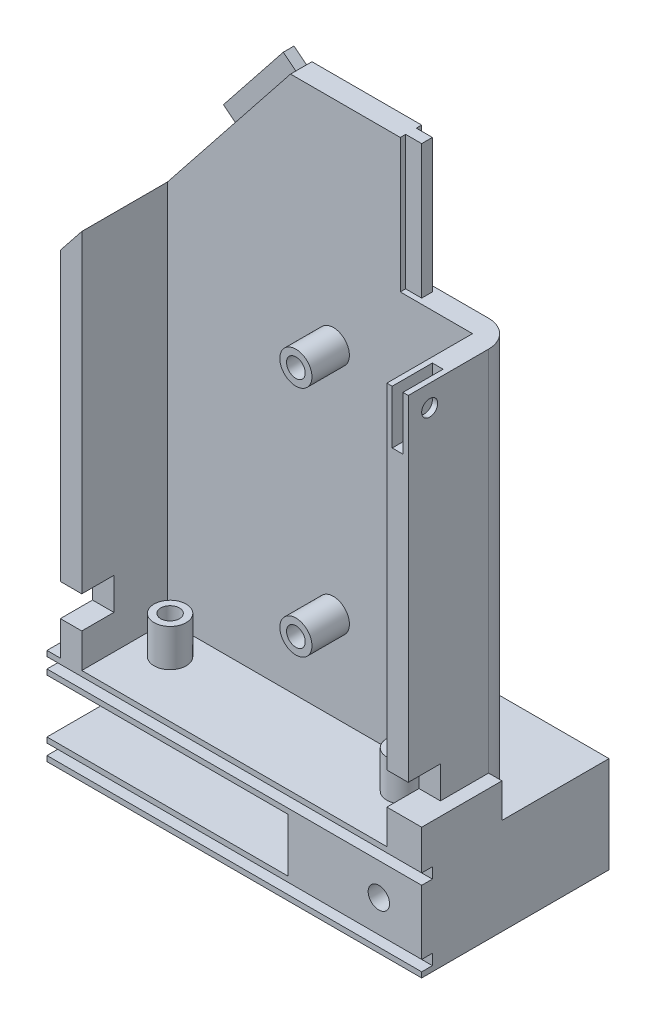
from build123d import *

# Parameters (mm, degrees)
SKETCH1_W                 = 65
SKETCH1_H                 = 40
BOSS_EXTRUDE1_DEPTH       = 100
SHELL1_T                  = -4
FILLET1_R                 = 5
CUT_EXTRUDE1_DEPTH        = 108.033873143
CUT_EXTRUDE1_DEPTH_BACK   = 108.033873143
CUT_EXTRUDE2_DEPTH        = 108.033873143
CUT_EXTRUDE2_DEPTH_BACK   = 108.033873143
SKETCH3_W                 = 17.5
SKETCH3_H                 = 25
SKETCH5_W                 = 2
SKETCH5_H                 = 25
BOSS_EXTRUDE2_DEPTH       = 3
SKETCH6_W                 = 2
SKETCH6_H                 = 18
BOSS_EXTRUDE3_DEPTH       = 3
SKETCH8_W                 = 70
SKETCH8_H                 = 70
BOSS_EXTRUDE4_DEPTH       = 18
SKETCH10_W                = 60
SKETCH10_H                = 10
CUT_EXTRUDE4_DEPTH        = 45
SKETCH23_W                = 2
SKETCH23_H                = 15
CUT_EXTRUDE10_DEPTH       = 10
CUT_EXTRUDE12_DEPTH       = 114.254624289
CUT_EXTRUDE12_DEPTH_BACK  = 114.254624289
SKETCH27_W                = 70
SKETCH27_H                = 35
SKETCH29_W                = 70
SKETCH29_H                = 2
CUT_EXTRUDE13_DEPTH       = 2
SKETCH30_W                = 70
SKETCH30_H                = 2
CUT_EXTRUDE14_DEPTH       = 2
CUT_EXTRUDE15_DEPTH       = 114.254624289
CUT_EXTRUDE15_DEPTH_BACK  = 114.254624289
SKETCH31_R                = 2
SKETCH33_R                = 4
CUT_EXTRUDE16_DEPTH       = 15
CUT_EXTRUDE17_DEPTH       = 114.254624289
CUT_EXTRUDE17_DEPTH_BACK  = 114.254624289
SKETCH34_R                = 1.5
SKETCH35_R                = 4
CUT_EXTRUDE18_DEPTH       = 2.5
SKETCH39_R                = 3
BOSS_EXTRUDE7_DEPTH       = 7
SKETCH40_R                = 1.75
CUT_EXTRUDE20_DEPTH       = 4
LPATTERN4_COUNT           = 2
LPATTERN4_PITCH           = 43.5
CUT_EXTRUDE21_DEPTH       = 128.113570962
CUT_EXTRUDE21_DEPTH_BACK  = 128.113570962
SKETCH41_W                = 6
SKETCH41_H                = 6
SKETCH42_W                = 15
SKETCH42_H                = 6.4
BOSS_EXTRUDE10_DEPTH      = 2.5
CUT_EXTRUDE22_DEPTH       = 128.113570962
CUT_EXTRUDE22_DEPTH_BACK  = 10
SKETCH43_R                = 1.5
SKETCH37_R                = 3
BOSS_EXTRUDE6_DEPTH       = 7
SKETCH38_R                = 1.75
CUT_EXTRUDE19_DEPTH       = 4
LPATTERN1_COUNT           = 2
LPATTERN1_PITCH           = 21
LPATTERN2_COUNT           = 2
LPATTERN2_PITCH           = 43.5
LPATTERN2_COPY_1_SKETCH_R = 3
LPATTERN2_COPY_1_DEPTH    = 7
LPATTERN2_COPY_2_SKETCH_R = 1.75
LPATTERN2_COPY_2_DEPTH    = 4


with BuildPart() as part:
    # Sketch1 → Boss-Extrude1 (new body)
    with BuildSketch(Plane(origin=(0, 0, 0), x_dir=(1, 0, 0), z_dir=(0, 1, 0))):
        Rectangle(SKETCH1_W, SKETCH1_H)
    extrude(amount=BOSS_EXTRUDE1_DEPTH)

    # Shell1
    shell1_openings = [part.faces().sort_by_distance(p)[0] for p in [
        (0, 100, 0),
        (0, 0, 0),
    ]]
    offset(amount=SHELL1_T, openings=shell1_openings, kind=Kind.INTERSECTION)

    # Fillet1
    fillet1_edges = [part.edges().sort_by_distance(p)[0] for p in [
        (32.5, 50, 20),
        (-32.5, 50, 20),
        (-32.5, 50, -20),
        (32.5, 50, -20),
    ]]
    fillet(fillet1_edges, radius=FILLET1_R)

    # Sketch2 → Cut-Extrude1 (cut, two sides: drawn at the far end of the back side and taken through both)
    with BuildSketch(Plane.XY.offset(-CUT_EXTRUDE1_DEPTH_BACK)):
        Polygon((-5.5, 100), (-32.5, 66), (-32.5, 100), align=None)
    extrude(amount=CUT_EXTRUDE1_DEPTH + CUT_EXTRUDE1_DEPTH_BACK, mode=Mode.SUBTRACT)

    # Sketch3 → Cut-Extrude2 (cut, two sides: drawn at the far end of the back side and taken through both)
    with BuildSketch(Plane.XY.offset(-CUT_EXTRUDE2_DEPTH_BACK)):
        with Locations((23.75, 87.5)):
            Rectangle(SKETCH3_W, SKETCH3_H)
    extrude(amount=CUT_EXTRUDE2_DEPTH + CUT_EXTRUDE2_DEPTH_BACK, mode=Mode.SUBTRACT)

    # Sketch5 → Boss-Extrude2 (add)
    with BuildSketch(Plane(origin=(15, 0, 0), x_dir=(0, 0, -1), z_dir=(1, 0, 0))):
        with Locations((-18, 87.5)):
            Rectangle(SKETCH5_W, SKETCH5_H)
    boss_extrude2 = extrude(amount=BOSS_EXTRUDE2_DEPTH)

    # Mirror1: Boss-Extrude2 across plane
    add(boss_extrude2.mirror(Plane.XY))

    # Sketch6 → Boss-Extrude3 (add)
    with BuildSketch(Plane(origin=(-52.073209549, 41.352254642, 0), x_dir=(0, 0, 1), z_dir=(-0.783110847498294, 0.6218821436015861, 0))):
        with Locations((-18, 65.89073296)):
            Rectangle(SKETCH6_W, SKETCH6_H)
    boss_extrude3 = extrude(amount=BOSS_EXTRUDE3_DEPTH)

    # Mirror2: Boss-Extrude3 across plane
    add(boss_extrude3.mirror(Plane.XY))

    # Sketch8 → Boss-Extrude4 (add)
    with BuildSketch(Plane(origin=(0, 0, 0), x_dir=(1, 0, 0), z_dir=(0, 1, 0))):
        Rectangle(SKETCH8_W, SKETCH8_H)
    extrude(amount=-BOSS_EXTRUDE4_DEPTH)

    # Sketch10 → Cut-Extrude4 (cut)
    with BuildSketch(Plane.ZY.offset(35)):
        with Locations((0, -9)):
            Rectangle(SKETCH10_W, SKETCH10_H)
    extrude(amount=-CUT_EXTRUDE4_DEPTH, mode=Mode.SUBTRACT)

    # Sketch23 → Cut-Extrude10 (cut)
    with BuildSketch(Plane(origin=(0, 75, 0), x_dir=(1, 0, 0), z_dir=(0, 1, 0))):
        with Locations((30.5, 0)):
            Rectangle(SKETCH23_W, SKETCH23_H)
    extrude(amount=-CUT_EXTRUDE10_DEPTH, mode=Mode.SUBTRACT)

    # Sketch27 → Cut-Extrude12 (cut, two sides: drawn at the far end of the back side and taken through both)
    with BuildSketch(Plane(origin=(0, 0, 0), x_dir=(1, 0, 0), z_dir=(0, 1, 0)).offset(-CUT_EXTRUDE12_DEPTH_BACK)):
        with Locations((0, -17.5)):
            Rectangle(SKETCH27_W, SKETCH27_H)
    extrude(amount=CUT_EXTRUDE12_DEPTH + CUT_EXTRUDE12_DEPTH_BACK, mode=Mode.SUBTRACT)

    # Sketch29 → Cut-Extrude13 (cut)
    with BuildSketch(Plane.XY):
        with Locations((0, -2)):
            Rectangle(SKETCH29_W, SKETCH29_H)
    extrude(amount=-CUT_EXTRUDE13_DEPTH, mode=Mode.SUBTRACT)

    # Sketch30 → Cut-Extrude14 (cut)
    with BuildSketch(Plane.XY):
        with Locations((0, -16)):
            Rectangle(SKETCH30_W, SKETCH30_H)
    extrude(amount=-CUT_EXTRUDE14_DEPTH, mode=Mode.SUBTRACT)

    # Sketch31 → Cut-Extrude15 (cut, two sides: drawn at the far end of the back side and taken through both)
    with BuildSketch(Plane.XY.offset(-CUT_EXTRUDE15_DEPTH_BACK)):
        with Locations((27, -9)):
            Circle(SKETCH31_R)
    extrude(amount=CUT_EXTRUDE15_DEPTH + CUT_EXTRUDE15_DEPTH_BACK, mode=Mode.SUBTRACT)

    # Sketch33 → Cut-Extrude16 (cut)
    with BuildSketch(Plane(origin=(0, 0, -35), x_dir=(-1, 0, 0), z_dir=(0, 0, -1))):
        with Locations((-27, -9)):
            Circle(SKETCH33_R)
    extrude(amount=-CUT_EXTRUDE16_DEPTH, mode=Mode.SUBTRACT)

    # Sketch34 → Cut-Extrude17 (cut, two sides: drawn at the far end of the back side and taken through both)
    with BuildSketch(Plane(origin=(0, 0, 0), x_dir=(1, 0, 0), z_dir=(0, 1, 0)).offset(-CUT_EXTRUDE17_DEPTH_BACK)):
        with Locations(Location((0, 27.5, 0), (0, 0, 270))):
            Circle(SKETCH34_R)
    extrude(amount=CUT_EXTRUDE17_DEPTH + CUT_EXTRUDE17_DEPTH_BACK, mode=Mode.SUBTRACT)

    # Sketch35 → Cut-Extrude18 (cut)
    with BuildSketch(Plane(origin=(0, -18, 0), x_dir=(-1, 0, 0), z_dir=(0, -1, 0))):
        with Locations(Location((0, 27.5, 0), (0, 0, 90))):
            Circle(SKETCH35_R)
    extrude(amount=-CUT_EXTRUDE18_DEPTH, mode=Mode.SUBTRACT)

    # Sketch39 → Boss-Extrude7 (add)
    with BuildSketch(Plane(origin=(0, 0, 0), x_dir=(1, 0, 0), z_dir=(0, 1, 0))):
        with Locations(Location((21, 10.5, 0), (0, 0, 90))):
            Circle(SKETCH39_R)
    boss_extrude7 = extrude(amount=BOSS_EXTRUDE7_DEPTH)

    # Sketch40 → Cut-Extrude20 (cut)
    with BuildSketch(Plane(origin=(0, 7, 0), x_dir=(1, 0, 0), z_dir=(0, 1, 0))):
        with Locations(Location((21, 10.5, 0), (0, 0, 270))):
            Circle(SKETCH40_R)
    cut_extrude20 = extrude(amount=-CUT_EXTRUDE20_DEPTH, mode=Mode.SUBTRACT)

    # LPattern4: Boss-Extrude7, Cut-Extrude20 ×2
    with Locations(*[(-i * LPATTERN4_PITCH, 0, 0) for i in range(1, LPATTERN4_COUNT)]):
        add(boss_extrude7)
        add(cut_extrude20, mode=Mode.SUBTRACT)

    # Sketch41 → Cut-Extrude21 (cut, two sides: drawn at the far end of the back side and taken through both)
    with BuildSketch(Plane(origin=(32.5, 0, 0), x_dir=(0, 0, -1), z_dir=(1, 0, 0)).offset(-CUT_EXTRUDE21_DEPTH_BACK)):
        with Locations((3, 9.4)):
            Rectangle(SKETCH41_W, SKETCH41_H)
    extrude(amount=CUT_EXTRUDE21_DEPTH + CUT_EXTRUDE21_DEPTH_BACK, mode=Mode.SUBTRACT)

    # Sketch42 → Boss-Extrude10 (add)
    with BuildSketch(Plane(origin=(32.5, 0, 0), x_dir=(0, 0, -1), z_dir=(1, 0, 0))):
        with Locations((7.5, 3.2)):
            Rectangle(SKETCH42_W, SKETCH42_H)
    extrude(amount=BOSS_EXTRUDE10_DEPTH)

    # Sketch43 → Cut-Extrude22 (cut, two sides: drawn at the far end of the back side and taken through both)
    with BuildSketch(Plane(origin=(32.5, 0, 0), x_dir=(0, 0, -1), z_dir=(1, 0, 0)).offset(-CUT_EXTRUDE22_DEPTH_BACK)):
        with Locations(Location((4, 71, 0), (0, 0, 180))):
            Circle(SKETCH43_R)
    extrude(amount=CUT_EXTRUDE22_DEPTH + CUT_EXTRUDE22_DEPTH_BACK, mode=Mode.SUBTRACT)

    # Sketch37 → Boss-Extrude6 (add)
    with BuildSketch(Plane.XY.offset(-16)):
        with Locations(Location((23.5, 60, 0), (0, 0, 180))):
            Circle(SKETCH37_R)
    boss_extrude6 = extrude(amount=BOSS_EXTRUDE6_DEPTH)

    # Sketch38 → Cut-Extrude19 (cut)
    with BuildSketch(Plane.XY.offset(-9)):
        with Locations((23.5, 60)):
            Circle(SKETCH38_R)
    cut_extrude19 = extrude(amount=-CUT_EXTRUDE19_DEPTH, mode=Mode.SUBTRACT)

    # LPattern1: Boss-Extrude6, Cut-Extrude19 ×2
    with Locations(*[(-i * LPATTERN1_PITCH, 0, 0) for i in range(1, LPATTERN1_COUNT)]):
        add(boss_extrude6)
        add(cut_extrude19, mode=Mode.SUBTRACT)

    # LPattern2: Boss-Extrude6, Cut-Extrude19 ×2
    with Locations(*[(0, -i * LPATTERN2_PITCH, 0) for i in range(1, LPATTERN2_COUNT)]):
        add(boss_extrude6)
        add(cut_extrude19, mode=Mode.SUBTRACT)

    # LPattern2 copy 1 sketch → LPattern2 copy 1 (add)
    with BuildSketch(Plane(origin=(-21, -43.5, -16), x_dir=(1, 0, 0), z_dir=(0, 0, 1))):
        with Locations(Location((23.5, 60, 0), (0, 0, 180))):
            Circle(LPATTERN2_COPY_1_SKETCH_R)
    extrude(amount=LPATTERN2_COPY_1_DEPTH)

    # LPattern2 copy 2 sketch → LPattern2 copy 2 (cut)
    with BuildSketch(Plane(origin=(-21, -43.5, -9), x_dir=(1, 0, 0), z_dir=(0, 0, 1))):
        with Locations((23.5, 60)):
            Circle(LPATTERN2_COPY_2_SKETCH_R)
    extrude(amount=-LPATTERN2_COPY_2_DEPTH, mode=Mode.SUBTRACT)


solid = part.part
